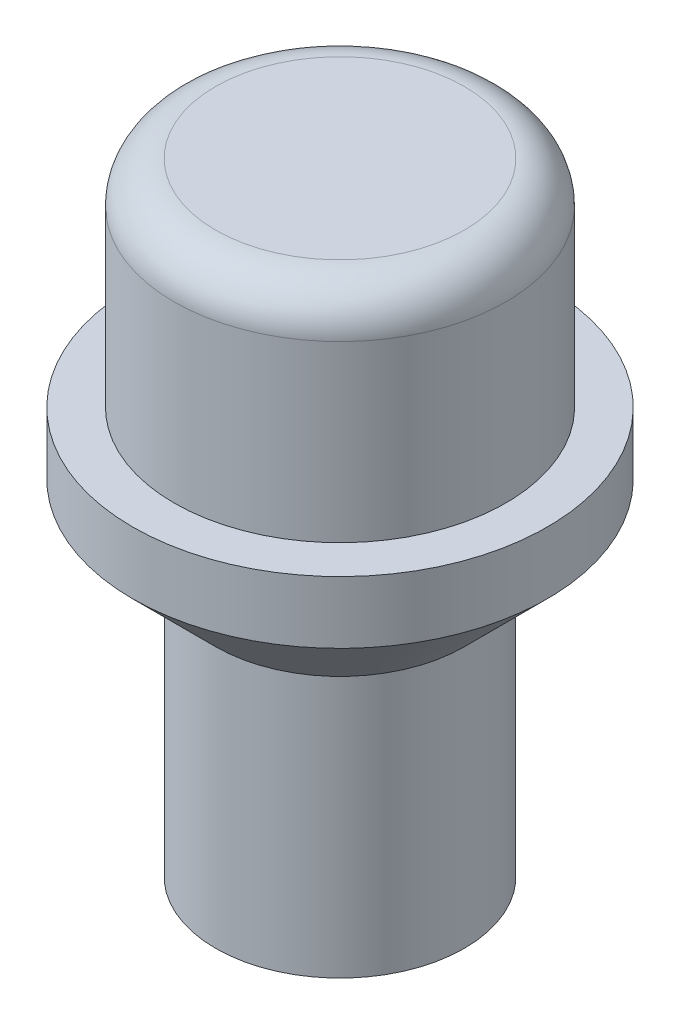
from build123d import *

# Parameters (mm, degrees)
FILLET_1_R = 1


with BuildPart() as part:
    # Эскиз2 → Повернуть1 (revolve)
    with BuildSketch(Plane(origin=(0, 0, 0), x_dir=(0, 0, -1), z_dir=(1, 0, 0)), mode=Mode.PRIVATE) as revolve_1_sk:
        Polygon((0, 0), (3, 0), (3, 6.3), (5, 8.3), (5, 9.8), (4, 9.8), (4, 15), (0, 15), align=None)
    revolve(revolve_1_sk.sketch.rotate(Axis((0, 8.655462185, 0), (0, -1, 0)), 180), axis=Axis((0, 8.655462185, 0), (0, -1, 0)))

    # Скругление1
    fillet_1_edges = [part.edges().sort_by_distance(p)[0] for p in [
        (0, 15, -4),
    ]]
    fillet(fillet_1_edges, radius=FILLET_1_R)


solid = part.part
